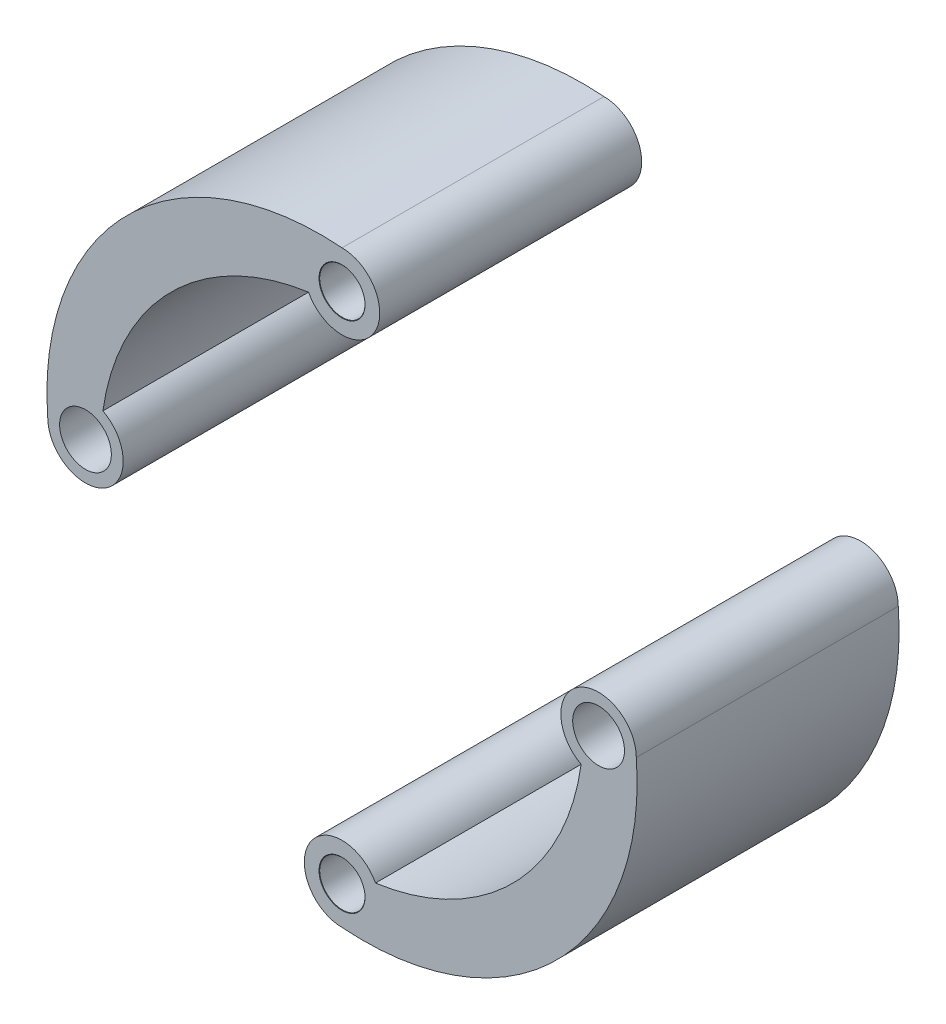
from build123d import *

# Parameters (mm, degrees)
SKETCH1_R                       = 2.5
BOSS_EXTRUDE1_DEPTH             = 17.3574
F_3_0MM_DOWEL_HOLE1_D           = 3
F_3_0MM_DOWEL_HOLE1_CSINK_D     = 3.05
F_3_0MM_DOWEL_HOLE1_CSINK_ANGLE = 100
SKETCH6_R                       = 1.715
CUT_EXTRUDE1_DEPTH              = 5
CUT_EXTRUDE2_START              = -5
SKETCH7_R                       = 1.715
CUT_EXTRUDE2_DEPTH              = 5


with BuildPart() as part:
    # Sketch1 → Boss-Extrude1 (new body)
    with BuildSketch(Plane(origin=(0, 0, 0), x_dir=(0, 1, 0), z_dir=(0, 0, 1))):
        with Locations((0, 17)):
            Circle(SKETCH1_R)
        with BuildLine():
            ThreePointArc((0, 19.5), (1.767766953, 18.767766953), (2.5, 17))
            ThreePointArc((2.5, 17), (2.428349784, 16.405763241), (2.217506139, 15.845588235))
            ThreePointArc((2.217506139, 15.845588235), (11.313708499, 11.313708499), (15.845588235, 2.217506139))
            ThreePointArc((15.845588235, 2.217506139), (18.296913757, 2.137291441), (19.5, 0))
            ThreePointArc((19.5, 0), (14.241833588, 14.241833588), (0, 19.5))
        make_face()
        with Locations((17, 0)):
            Circle(SKETCH1_R)
        with Locations((-17, 0)):
            Circle(SKETCH1_R)
        with Locations((0, -17)):
            Circle(SKETCH1_R)
        with BuildLine():
            ThreePointArc((0, -19.5), (-2.137291441, -18.296913757), (-2.217506139, -15.845588235))
            ThreePointArc((-2.217506139, -15.845588235), (-11.313708499, -11.313708499), (-15.845588235, -2.217506139))
            ThreePointArc((-15.845588235, -2.217506139), (-18.296913757, -2.137291441), (-19.5, 0))
            ThreePointArc((-19.5, 0), (-14.241833588, -14.241833588), (0, -19.5))
        make_face()
    extrude(amount=BOSS_EXTRUDE1_DEPTH)

    # Ø3.0mm Dowel Hole1 (through all)
    with Locations(Plane.XY.offset(17.3574)):
        with Locations((0, 17), (0, -17)):
            CounterSinkHole(F_3_0MM_DOWEL_HOLE1_D / 2, F_3_0MM_DOWEL_HOLE1_CSINK_D / 2, counter_sink_angle=F_3_0MM_DOWEL_HOLE1_CSINK_ANGLE)

    # Sketch6 → Cut-Extrude1 (cut)
    with BuildSketch(Plane.XY.offset(17.3574)):
        with Locations((-17, 0)):
            Circle(SKETCH6_R)
        with Locations((17, 0)):
            Circle(SKETCH6_R)
    extrude(amount=-CUT_EXTRUDE1_DEPTH, mode=Mode.SUBTRACT)

    # Sketch7 → Cut-Extrude2 (cut)
    with BuildSketch(Plane(origin=(0, 0, 0), x_dir=(1, 0, 0), z_dir=(0, 0, -1)).offset(CUT_EXTRUDE2_START)):
        with Locations((-17, 0)):
            Circle(SKETCH7_R)
        with Locations((17, 0)):
            Circle(SKETCH7_R)
    extrude(amount=CUT_EXTRUDE2_DEPTH, mode=Mode.SUBTRACT)


solid = part.part
